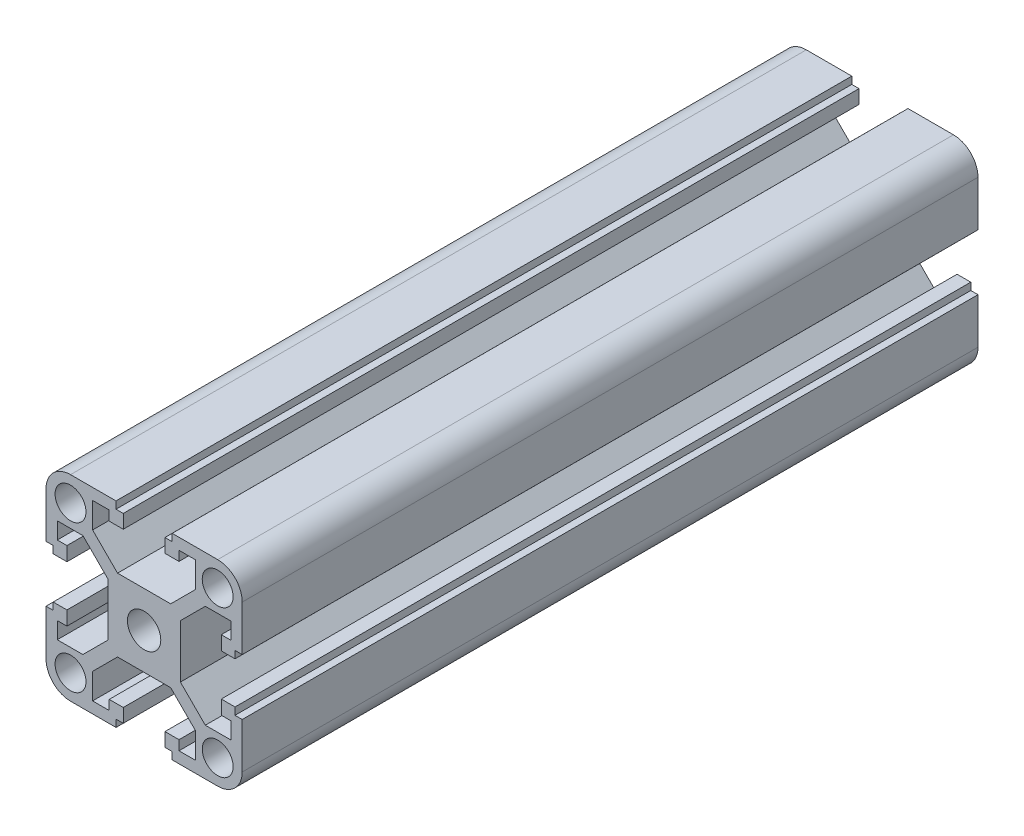
from build123d import *

# Parameters (mm, degrees)
SKETCH_1_R      = 3.4
SKETCH_1_R_2    = 3.15
EXTRUDE_1_DEPTH = 75


with BuildPart() as part:
    # Эскиз1 → Бобышка-Вытянуть1 (new, symmetric)
    with BuildSketch(Plane.XY):
        with BuildLine():
            Line((-15, 20), (-5.727351849, 20))
            Line((-5.727351849, 20), (-5.727351849, 18.530416438))
            Line((-5.727351849, 18.530416438), (-4.25, 18.530416438))
            Line((-4.25, 18.530416438), (-4.25, 15.732027397))
            Line((-4.25, 15.732027397), (-7.111831817, 15.732027397))
            Line((-7.111831817, 15.732027397), (-7.111831817, 17.7))
            Line((-7.111831817, 17.7), (-10.5, 17.7))
            Line((-10.5, 17.7), (-10.5, 12.479898987))
            Line((-10.5, 12.479898987), (-5.420101013, 7.4))
            Line((-5.420101013, 7.4), (5.420101013, 7.4))
            Line((5.420101013, 7.4), (10.5, 12.479898987))
            Line((10.5, 12.479898987), (10.5, 17.7))
            Line((10.5, 17.7), (7.111831817, 17.7))
            Line((7.111831817, 17.7), (7.111831817, 15.732027397))
            Line((7.111831817, 15.732027397), (4.25, 15.732027397))
            Line((4.25, 15.732027397), (4.25, 18.530416438))
            Line((4.25, 18.530416438), (5.727351849, 18.530416438))
            Line((5.727351849, 18.530416438), (5.727351849, 20))
            Line((5.727351849, 20), (15, 20))
            ThreePointArc((15, 20), (18.535533906, 18.535533906), (20, 15))
            Line((20, 15), (20, 5.727351849))
            Line((20, 5.727351849), (18.530416438, 5.727351849))
            Line((18.530416438, 5.727351849), (18.530416438, 4.25))
            Line((18.530416438, 4.25), (15.732027397, 4.25))
            Line((15.732027397, 4.25), (15.732027397, 7.111831817))
            Line((15.732027397, 7.111831817), (17.7, 7.111831817))
            Line((17.7, 7.111831817), (17.7, 10.5))
            Line((17.7, 10.5), (12.479898987, 10.5))
            Line((12.479898987, 10.5), (7.4, 5.420101013))
            Line((7.4, 5.420101013), (7.4, -5.420101013))
            Line((7.4, -5.420101013), (12.479898987, -10.5))
            Line((12.479898987, -10.5), (17.7, -10.5))
            Line((17.7, -10.5), (17.7, -7.111831817))
            Line((17.7, -7.111831817), (15.732027397, -7.111831817))
            Line((15.732027397, -7.111831817), (15.732027397, -4.25))
            Line((15.732027397, -4.25), (18.530416438, -4.25))
            Line((18.530416438, -4.25), (18.530416438, -5.727351849))
            Line((18.530416438, -5.727351849), (20, -5.727351849))
            Line((20, -5.727351849), (20, -15))
            ThreePointArc((20, -15), (18.535533906, -18.535533906), (15, -20))
            Line((15, -20), (5.727351849, -20))
            Line((5.727351849, -20), (5.727351849, -18.530416438))
            Line((5.727351849, -18.530416438), (4.25, -18.530416438))
            Line((4.25, -18.530416438), (4.25, -15.732027397))
            Line((4.25, -15.732027397), (7.111831817, -15.732027397))
            Line((7.111831817, -15.732027397), (7.111831817, -17.7))
            Line((7.111831817, -17.7), (10.5, -17.7))
            Line((10.5, -17.7), (10.5, -12.479898987))
            Line((10.5, -12.479898987), (5.420101013, -7.4))
            Line((5.420101013, -7.4), (-5.420101013, -7.4))
            Line((-5.420101013, -7.4), (-10.5, -12.479898987))
            Line((-10.5, -12.479898987), (-10.5, -17.7))
            Line((-10.5, -17.7), (-7.111831817, -17.7))
            Line((-7.111831817, -17.7), (-7.111831817, -15.732027397))
            Line((-7.111831817, -15.732027397), (-4.25, -15.732027397))
            Line((-4.25, -15.732027397), (-4.25, -18.530416438))
            Line((-4.25, -18.530416438), (-5.727351849, -18.530416438))
            Line((-5.727351849, -18.530416438), (-5.727351849, -20))
            Line((-5.727351849, -20), (-15, -20))
            ThreePointArc((-15, -20), (-18.535533906, -18.535533906), (-20, -15))
            Line((-20, -15), (-20, -5.727351849))
            Line((-20, -5.727351849), (-18.530416438, -5.727351849))
            Line((-18.530416438, -5.727351849), (-18.530416438, -4.25))
            Line((-18.530416438, -4.25), (-15.732027397, -4.25))
            Line((-15.732027397, -4.25), (-15.732027397, -7.111831817))
            Line((-15.732027397, -7.111831817), (-17.7, -7.111831817))
            Line((-17.7, -7.111831817), (-17.7, -10.5))
            Line((-17.7, -10.5), (-12.479898987, -10.5))
            Line((-12.479898987, -10.5), (-7.4, -5.420101013))
            Line((-7.4, -5.420101013), (-7.4, 5.420101013))
            Line((-7.4, 5.420101013), (-12.479898987, 10.5))
            Line((-12.479898987, 10.5), (-17.7, 10.5))
            Line((-17.7, 10.5), (-17.7, 7.111831817))
            Line((-17.7, 7.111831817), (-15.732027397, 7.111831817))
            Line((-15.732027397, 7.111831817), (-15.732027397, 4.25))
            Line((-15.732027397, 4.25), (-18.530416438, 4.25))
            Line((-18.530416438, 4.25), (-18.530416438, 5.727351849))
            Line((-18.530416438, 5.727351849), (-20, 5.727351849))
            Line((-20, 5.727351849), (-20, 15))
            ThreePointArc((-20, 15), (-18.535533906, 18.535533906), (-15, 20))
        make_face()
        Circle(SKETCH_1_R, mode=Mode.SUBTRACT)
        with Locations((-15, 15)):
            Circle(SKETCH_1_R_2, mode=Mode.SUBTRACT)
        with Locations((15, 15)):
            Circle(SKETCH_1_R_2, mode=Mode.SUBTRACT)
        with Locations((15, -15)):
            Circle(SKETCH_1_R_2, mode=Mode.SUBTRACT)
        with Locations((-15, -15)):
            Circle(SKETCH_1_R_2, mode=Mode.SUBTRACT)
    extrude(amount=EXTRUDE_1_DEPTH, both=True)


solid = part.part
